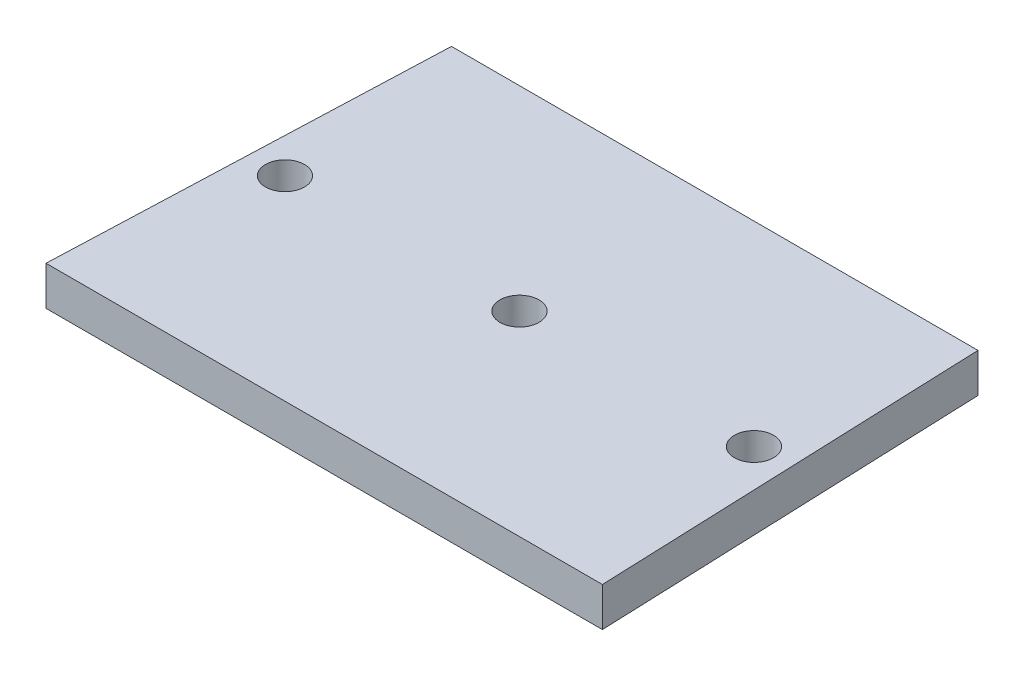
from build123d import *

# Parameters (mm, degrees)
SALIENTE_EXTRUIR1_DEPTH = 3
CROQUIS2_R              = 1.5
CORTAR_EXTRUIR1_DEPTH   = 4
CROQUIS3_W              = 40.415918572
CROQUIS3_H              = 97.617868818
CROQUIS3_W_2            = 62.592919448
CROQUIS3_H_2            = 252.082446821
CORTAR_EXTRUIR2_DEPTH   = 18


with BuildPart() as part:
    # Croquis1 → Saliente-Extruir1 (new body)
    with BuildSketch(Plane(origin=(0, 0, 0), x_dir=(1, 0, 0), z_dir=(0, 1, 0))):
        Polygon((31, -188.773821898), (-31, -188.773821898), (-16.554484331, 188.773821898), (16.554484331, 188.773821898), align=None)
    extrude(amount=SALIENTE_EXTRUIR1_DEPTH)

    # Croquis2 → Cortar-Extruir1 (cut)
    with BuildSketch(Plane(origin=(0, 3, 0), x_dir=(1, 0, 0), z_dir=(0, 1, 0))):
        with Locations(Location((0, 78.297657431, 0), (0, 0, 270))):
            Circle(CROQUIS2_R)
        with Locations(Location((-18, 78.297657431, 0), (0, 0, 270))):
            Circle(CROQUIS2_R)
        with Locations(Location((18, 78.297657431, 0), (0, 0, 270))):
            Circle(CROQUIS2_R)
    extrude(amount=-CORTAR_EXTRUIR1_DEPTH, mode=Mode.SUBTRACT)

    # Croquis3 → Cortar-Extruir2 (cut)
    with BuildSketch(Plane(origin=(0, 3, 0), x_dir=(1, 0, 0), z_dir=(0, 1, 0))):
        with Locations((0, 142.095624348)):
            Rectangle(CROQUIS3_W, CROQUIS3_H)
        with Locations((0.296459724, -62.732598488)):
            Rectangle(CROQUIS3_W_2, CROQUIS3_H_2)
    extrude(amount=-CORTAR_EXTRUIR2_DEPTH, mode=Mode.SUBTRACT)


solid = part.part
